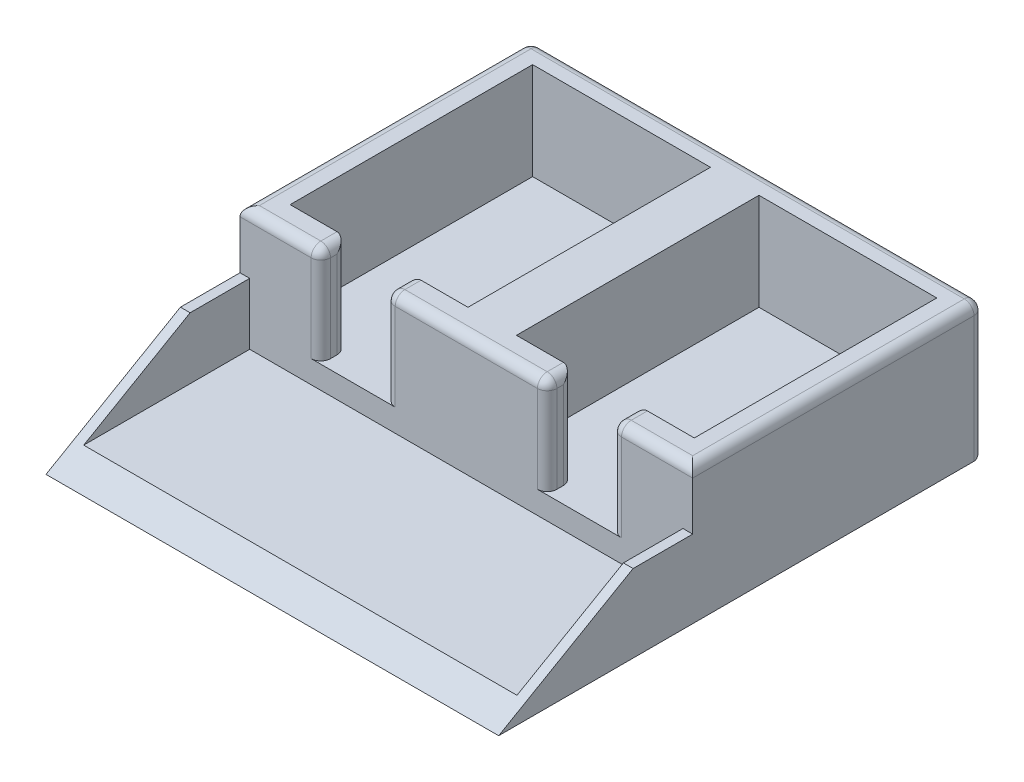
from build123d import *

# Parameters (mm, degrees)
SKETCH1_W               = 140
SKETCH1_H               = 90
BOSS_EXTRUDE1_DEPTH     = 42
CUT_EXTRUDE1_DEPTH      = 30
FILLET2_R               = 3
SKETCH3_W               = 140
SKETCH3_H               = 60
BOSS_EXTRUDE2_DEPTH     = 5
SKETCH4_W               = 3
SKETCH4_H               = 60
BOSS_EXTRUDE3_DEPTH     = 19
CUT_EXTRUDE2_DEPTH      = 172.650808329
CUT_EXTRUDE2_DEPTH_BACK = 172.650808329


with BuildPart() as part:
    # Sketch1 → Boss-Extrude1 (new body)
    with BuildSketch(Plane(origin=(0, 0, 0), x_dir=(1, 0, 0), z_dir=(0, 1, 0))):
        with Locations((70, 45)):
            Rectangle(SKETCH1_W, SKETCH1_H)
    extrude(amount=BOSS_EXTRUDE1_DEPTH)

    # Sketch2 → Cut-Extrude1 (cut)
    with BuildSketch(Plane(origin=(0, 42, 0), x_dir=(1, 0, 0), z_dir=(0, 1, 0))):
        Polygon((7.5, 8), (7.5, 83), (62.5, 83), (62.5, 8), (45, 8), (45, 0), (25, 0), (25, 8), align=None)
        Polygon((77.5, 8), (77.5, 83), (132.5, 83), (132.5, 8), (115, 8), (115, 0), (95, 0), (95, 8), align=None)
    extrude(amount=-CUT_EXTRUDE1_DEPTH, mode=Mode.SUBTRACT)

    # Fillet2
    fillet2_edges = [part.edges().sort_by_distance(p)[0] for p in [
        (140, 42, -45),
        (70, 42, 0),
        (127.5, 42, 0),
        (70, 42, -90),
        (25, 27, -8),
        (45, 27, -8),
        (45, 27, 0),
        (25, 27, 0),
        (25, 42, -4),
        (45, 42, -4),
        (95, 27, -8),
        (115, 27, -8),
        (115, 27, 0),
        (95, 27, 0),
        (95, 42, -4),
        (115, 42, -4),
        (0, 42, -45),
        (70, 0, -90),
        (0, 21, -90),
        (140, 21, -90),
        (12.5, 42, 0),
    ]]
    fillet(fillet2_edges, radius=FILLET2_R)

    # Sketch3 → Boss-Extrude2 (add)
    with BuildSketch(Plane(origin=(0, 0, 0), x_dir=(1, 0, 0), z_dir=(0, 1, 0))):
        with Locations((70, -30)):
            Rectangle(SKETCH3_W, SKETCH3_H)
    extrude(amount=BOSS_EXTRUDE2_DEPTH)

    # Sketch4 → Boss-Extrude3 (add)
    with BuildSketch(Plane(origin=(0, 5, 0), x_dir=(1, 0, 0), z_dir=(0, 1, 0))):
        with Locations((1.5, -30)):
            Rectangle(SKETCH4_W, SKETCH4_H)
        with Locations((138.5, -30)):
            Rectangle(SKETCH4_W, SKETCH4_H)
    extrude(amount=BOSS_EXTRUDE3_DEPTH)

    # Sketch5 → Cut-Extrude2 (cut, two sides: drawn at the far end of the back side and taken through both)
    with BuildSketch(Plane.ZY.offset(-CUT_EXTRUDE2_DEPTH_BACK)):
        Polygon((60, 0), (8.038475773, 30), (60, 30), align=None)
    extrude(amount=CUT_EXTRUDE2_DEPTH + CUT_EXTRUDE2_DEPTH_BACK, mode=Mode.SUBTRACT)


solid = part.part
